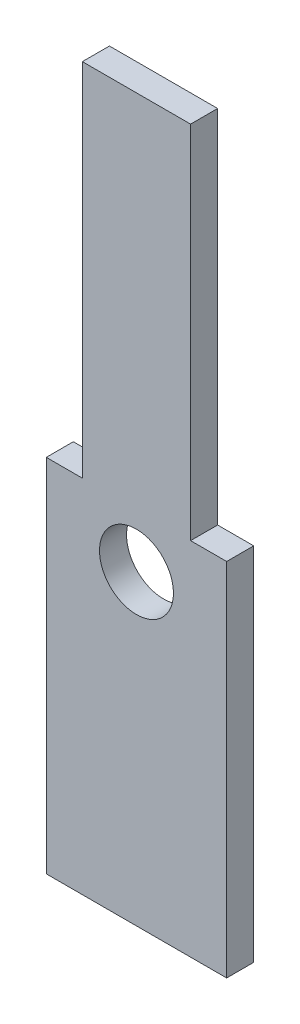
from build123d import *

# Parameters (mm, degrees)
SKETCH1_W           = 20
SKETCH1_H           = 40
BOSS_EXTRUDE1_DEPTH = 3
SKETCH2_R           = 4.1
CUT_EXTRUDE1_DEPTH  = 3
SKETCH3_W           = 12
SKETCH3_H           = 3
BOSS_EXTRUDE2_DEPTH = 40


with BuildPart() as part:
    # Sketch1 → Boss-Extrude1 (new body)
    with BuildSketch(Plane.XY):
        with Locations((0, 20)):
            Rectangle(SKETCH1_W, SKETCH1_H)
    extrude(amount=-BOSS_EXTRUDE1_DEPTH)

    # Sketch2 → Cut-Extrude1 (cut)
    with BuildSketch(Plane.XY):
        with Locations((0, 34)):
            Circle(SKETCH2_R)
    extrude(amount=-CUT_EXTRUDE1_DEPTH, mode=Mode.SUBTRACT)

    # Sketch3 → Boss-Extrude2 (add)
    with BuildSketch(Plane(origin=(0, 40, 0), x_dir=(1, 0, 0), z_dir=(0, 1, 0))):
        with Locations((0, 1.5)):
            Rectangle(SKETCH3_W, SKETCH3_H)
    extrude(amount=BOSS_EXTRUDE2_DEPTH)


solid = part.part
